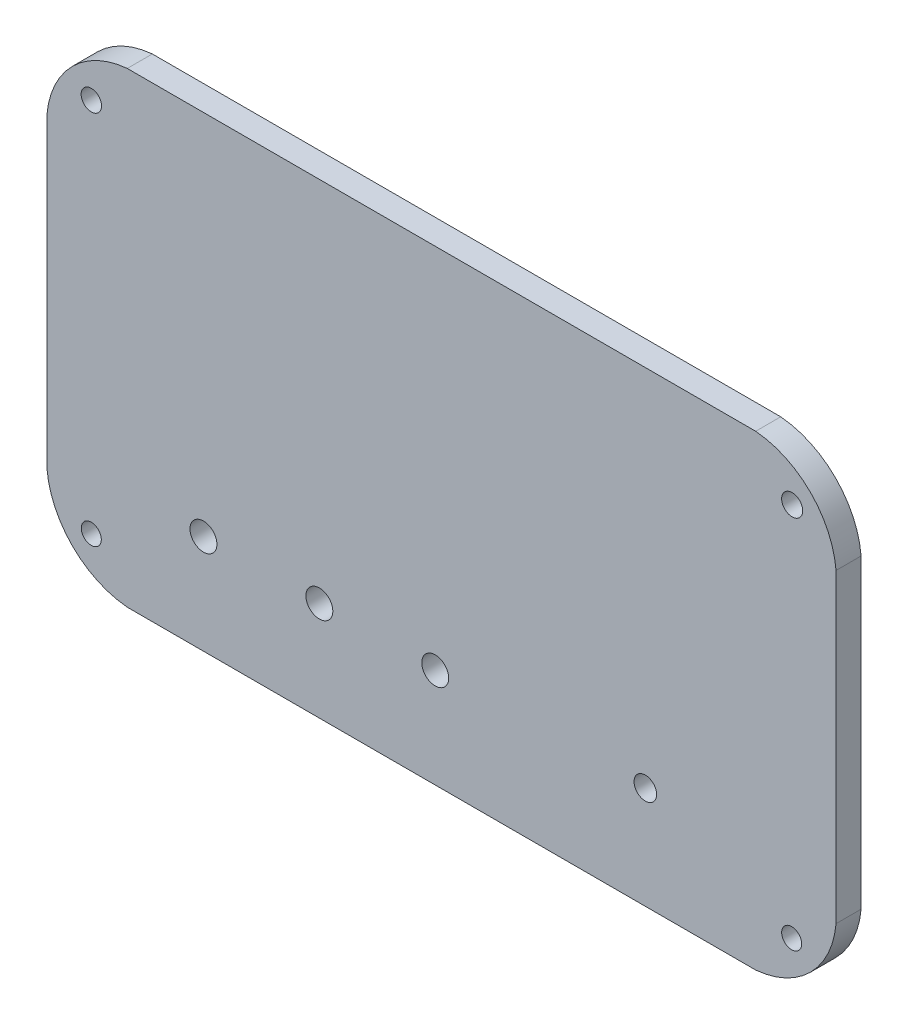
from build123d import *

# Parameters (mm, degrees)
EXTRUDE_1_DEPTH     = 4
SKETCH_2_R          = 2.15
SKETCH_2_R_2        = 1.8
CUT_EXTRUDE_1_DEPTH = 4
SKETCH_3_R          = 1.682371235
SKETCH_3_R_2        = 1.63184694
SKETCH_3_R_3        = 1.6
CUT_EXTRUDE_2_DEPTH = 4


with BuildPart() as part:
    # Эскиз1 → Бобышка-Вытянуть1 (new body)
    with BuildSketch(Plane.XY):
        with BuildLine():
            Line((63, -22.965754466), (63, 25.873855155))
            ThreePointArc((63, 25.873855155), (58.922335459, 34.626385804), (50.169804811, 38.704050345))
            Line((50.169804811, 38.704050345), (-50.169804811, 38.704050345))
            ThreePointArc((-50.169804811, 38.704050345), (-58.922335459, 34.626385804), (-63, 25.873855155))
            Line((-63, 25.873855155), (-63, -22.965754466))
            ThreePointArc((-63, -22.965754466), (-58.922335459, -31.718285114), (-50.169804811, -35.795949655))
            Line((-50.169804811, -35.795949655), (50.169804811, -35.795949655))
            ThreePointArc((50.169804811, -35.795949655), (58.922335459, -31.718285114), (63, -22.965754466))
        make_face()
    extrude(amount=EXTRUDE_1_DEPTH)

    # Эскиз2 → Вырез-Вытянуть1 (cut)
    with BuildSketch(Plane.XY.offset(4)):
        with Locations((-38, -19.945949655)):
            Circle(SKETCH_2_R)
        with Locations((32.554227521, -19.442510909)):
            Circle(SKETCH_2_R_2)
        with Locations((-19.5, -19.945949655)):
            Circle(SKETCH_2_R)
        with Locations((-1, -19.945949655)):
            Circle(SKETCH_2_R)
    extrude(amount=-CUT_EXTRUDE_1_DEPTH, mode=Mode.SUBTRACT)

    # Эскиз3 → Вырез-Вытянуть2 (cut)
    with BuildSketch(Plane(origin=(0, 0, 0), x_dir=(-1, 0, 0), z_dir=(0, 0, -1))):
        with Locations((-55.991619652, 31.455233256)):
            Circle(SKETCH_3_R)
        with Locations((55.90524563, 31.455233256)):
            Circle(SKETCH_3_R_2)
        with Locations((-55.91502671, -28.516824843)):
            Circle(SKETCH_3_R_3)
        with Locations((55.91502671, -28.516824843)):
            Circle(SKETCH_3_R_3)
    extrude(amount=-CUT_EXTRUDE_2_DEPTH, mode=Mode.SUBTRACT)


solid = part.part
